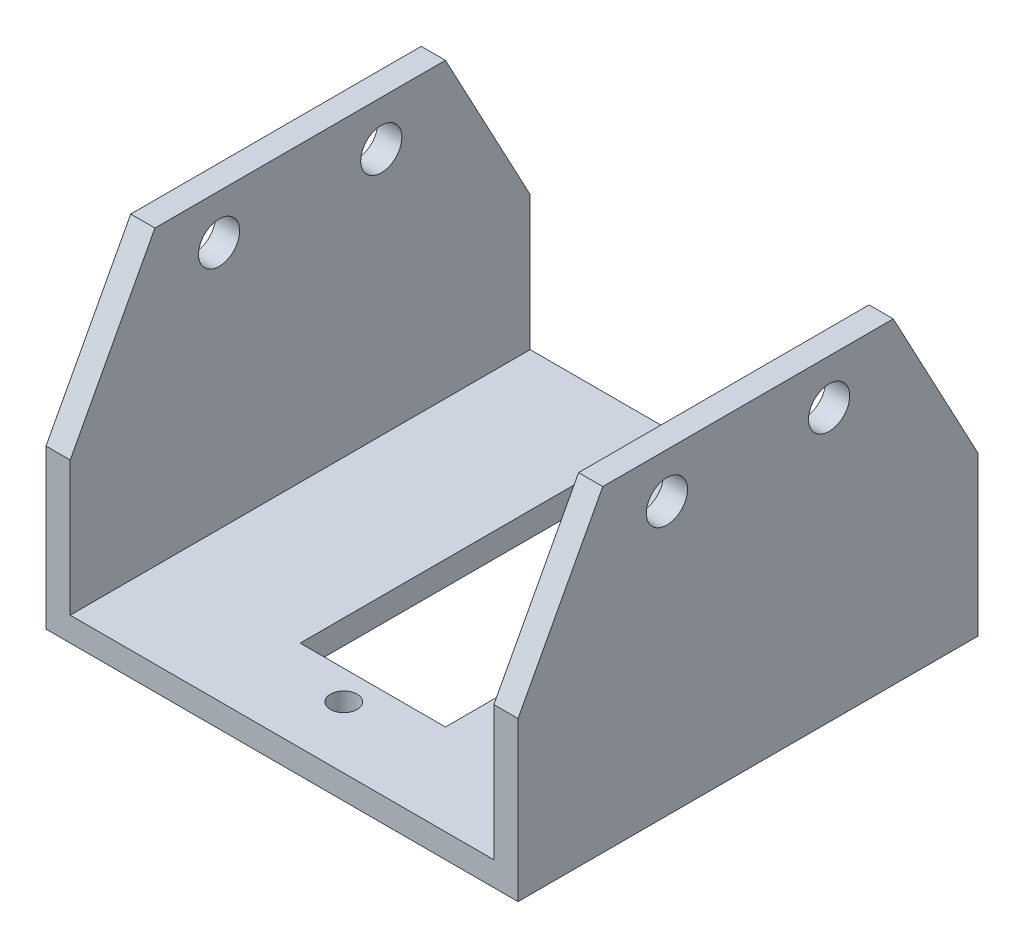
from build123d import *

# Parameters (mm, degrees)
SKETCH_2_R          = 1.1
SKETCH_2_W          = 12
SKETCH_2_H          = 23
EXTRUDE_2_DEPTH     = 2
SKETCH_4_W          = 2
SKETCH_4_H          = 38
EXTRUDE_3_DEPTH     = 24.2
SKETCH_5_W          = 2
SKETCH_5_H          = 38
EXTRUDE_4_DEPTH     = 24.2
SKETCH_6_R          = 1.7
CUT_EXTRUDE_1_DEPTH = 50
CUT_EXTRUDE_2_DEPTH = 39


with BuildPart() as part:
    # 草图2 → 凸台-拉伸2 (new body)
    with BuildSketch(Plane(origin=(0, 0, 0), x_dir=(1, 0, 0), z_dir=(0, 1, 0))):
        Polygon((-39.22677438, -4.600854345), (-4.22677438, -4.600854345), (-2.22677438, -4.600854345), (-2.22677438, -42.600854345), (-4.22677438, -42.600854345), (-39.22677438, -42.600854345), (-41.22677438, -42.600854345), (-41.22677438, -4.600854345), align=None)
        with Locations(Location((-21.72677438, -9.700854345, 0), (0, 0, 270))):
            Circle(SKETCH_2_R, mode=Mode.SUBTRACT)
        with Locations(Location((-21.72677438, -37.500854345, 0), (0, 0, 90))):
            Circle(SKETCH_2_R, mode=Mode.SUBTRACT)
        with Locations((-21.72677438, -23.600854345)):
            Rectangle(SKETCH_2_W, SKETCH_2_H, mode=Mode.SUBTRACT)
    extrude(amount=EXTRUDE_2_DEPTH)

    # 草图4 → 凸台-拉伸3 (add)
    with BuildSketch(Plane(origin=(0, 2, 0), x_dir=(1, 0, 0), z_dir=(0, 1, 0))):
        with Locations((-40.22677438, -23.600854345)):
            Rectangle(SKETCH_4_W, SKETCH_4_H)
    extrude(amount=EXTRUDE_3_DEPTH)

    # 草图5 → 凸台-拉伸4 (add)
    with BuildSketch(Plane(origin=(0, 2, 0), x_dir=(1, 0, 0), z_dir=(0, 1, 0))):
        with Locations((-3.22677438, -23.600854345)):
            Rectangle(SKETCH_5_W, SKETCH_5_H)
    extrude(amount=EXTRUDE_4_DEPTH)

    # 草图6 → 切除-拉伸1 (cut)
    with BuildSketch(Plane(origin=(-2.22677438, 0, 0), x_dir=(0, 0, -1), z_dir=(1, 0, 0))):
        with Locations((-30.300854345, 22.5)):
            Circle(SKETCH_6_R)
        with Locations((-16.900854345, 22.5)):
            Circle(SKETCH_6_R)
    extrude(amount=-CUT_EXTRUDE_1_DEPTH, mode=Mode.SUBTRACT)

    # 草图7 → 切除-拉伸2 (cut)
    with BuildSketch(Plane(origin=(-2.22677438, 0, 0), x_dir=(0, 0, -1), z_dir=(1, 0, 0))):
        Polygon((-35.600854345, 26.2), (-42.600854345, 13.1), (-42.600854345, 26.2), align=None)
        Polygon((-11.600854345, 26.2), (-4.600854345, 13.1), (-4.600854345, 26.2), align=None)
    extrude(amount=-CUT_EXTRUDE_2_DEPTH, mode=Mode.SUBTRACT)


solid = part.part
